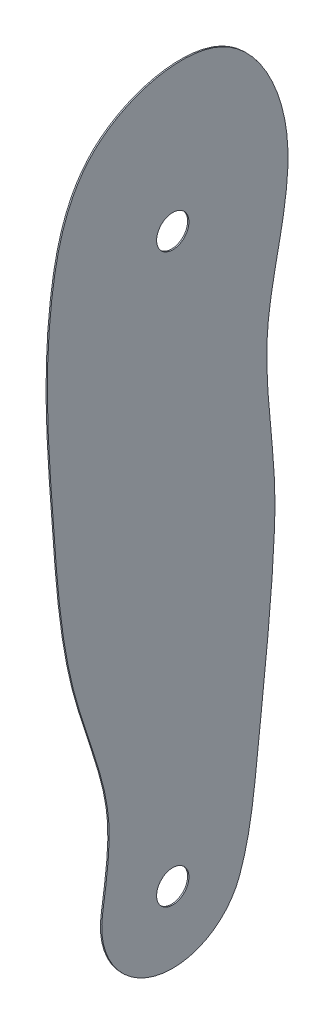
from build123d import *

# Parameters (mm, degrees)
SKETCH3_R      = 12.5
EXTRUDE1_DEPTH = 0.5


with BuildPart() as part:
    # Sketch3 → Extrude1 (new, symmetric)
    with BuildSketch(Plane(origin=(0, 0, 0), x_dir=(0, 0, -1), z_dir=(1, 0, 0))):
        with BuildLine():
            ThreePointArc((-54.264629319, -430.1205318), (-13.7913432, -492.327177342), (51.792462157, -457.592207733))
            add(Edge.make_bspline(
                [(51.792462157, -457.592207733), (60.160737737, -434.174394559), (67.488557818, -363.130683175), (77.211652356, -282.10154118), (80.640939811, -188.942019152), (61.227186472, -97.629247127), (106.857747088, 11.193424084), (47.123708687, 128.828975779), (-73.211452192, 98.522322742), (-102.635455482, -20.015832449), (-92.657554192, -140.9581989), (-84.605008828, -265.664856057), (-43.772598001, -358.409103601), (-50.665135202, -405.518540428), (-54.264629319, -430.1205318)],
                knots=[0, 0, 0, 0, 0.060565141, 0.17194477, 0.195187912, 0.292996563, 0.398656703, 0.47910956, 0.561345808, 0.633895113, 0.762588455, 0.86856081, 0.947252355, 1, 1, 1, 1], degree=3))
        make_face()
        Circle(SKETCH3_R, mode=Mode.SUBTRACT)
        with Locations((0, -439.084348222)):
            Circle(SKETCH3_R, mode=Mode.SUBTRACT)
    extrude(amount=EXTRUDE1_DEPTH, both=True)


solid = part.part
